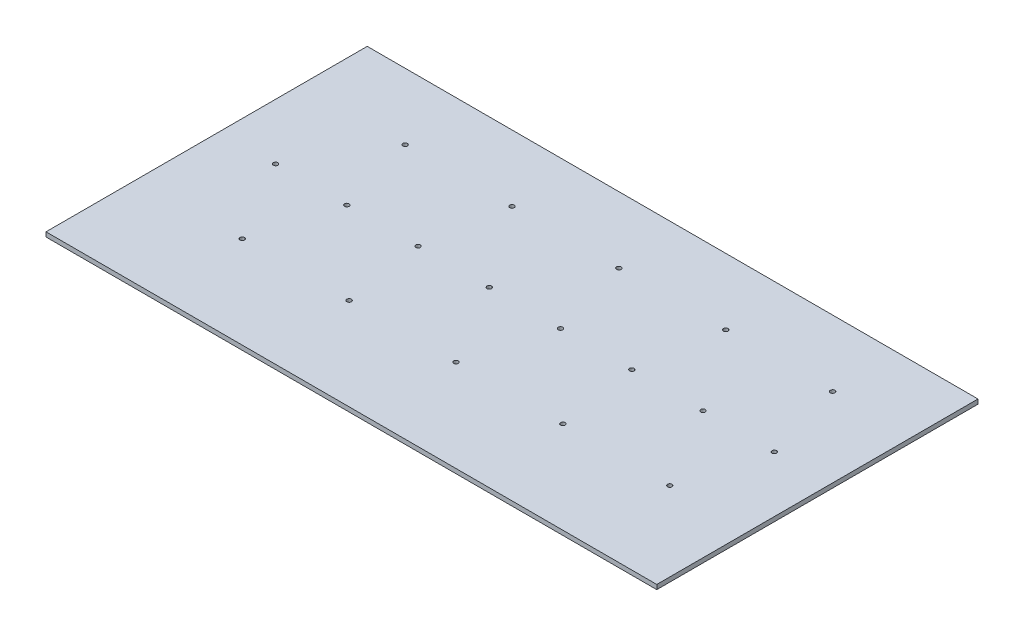
from build123d import *

# Parameters (mm, degrees)
SKETCH1_W               = 857.25
SKETCH1_H               = 450.85
BOSS_EXTRUDE1_DEPTH     = 6.35
CUT_EXTRUDE1_DEPTH      = 969.598785618
CUT_EXTRUDE1_DEPTH_BACK = 969.598785618
SKETCH2_R               = 3.175


with BuildPart() as part:
    # Sketch1 → Boss-Extrude1 (new body)
    with BuildSketch(Plane(origin=(0, 0, 0), x_dir=(1, 0, 0), z_dir=(0, 1, 0))):
        with Locations((428.625, 225.425)):
            Rectangle(SKETCH1_W, SKETCH1_H)
    extrude(amount=BOSS_EXTRUDE1_DEPTH)

    # Sketch2 → Cut-Extrude1 (cut, two sides: drawn at the far end of the back side and taken through both)
    with BuildSketch(Plane(origin=(0, 6.35, 0), x_dir=(1, 0, 0), z_dir=(0, 1, 0)).offset(-CUT_EXTRUDE1_DEPTH_BACK)):
        with Locations(Location((78.625, 243.56780677, 0), (0, 0, 270))):
            Circle(SKETCH2_R)
        with Locations(Location((178.625, 243.56780677, 0), (0, 0, 270))):
            Circle(SKETCH2_R)
        with Locations(Location((278.625, 243.56780677, 0), (0, 0, 270))):
            Circle(SKETCH2_R)
        with Locations(Location((378.625, 243.56780677, 0), (0, 0, 270))):
            Circle(SKETCH2_R)
        with Locations(Location((478.625, 243.56780677, 0), (0, 0, 270))):
            Circle(SKETCH2_R)
        with Locations(Location((578.625, 243.56780677, 0), (0, 0, 270))):
            Circle(SKETCH2_R)
        with Locations(Location((678.625, 243.56780677, 0), (0, 0, 270))):
            Circle(SKETCH2_R)
        with Locations(Location((778.625, 243.56780677, 0), (0, 0, 270))):
            Circle(SKETCH2_R)
        with Locations(Location((146.163, 357.86780677, 0), (0, 0, 270))):
            Circle(SKETCH2_R)
        with Locations(Location((296.163, 357.86780677, 0), (0, 0, 270))):
            Circle(SKETCH2_R)
        with Locations(Location((446.163, 357.86780677, 0), (0, 0, 270))):
            Circle(SKETCH2_R)
        with Locations(Location((596.163, 357.86780677, 0), (0, 0, 270))):
            Circle(SKETCH2_R)
        with Locations(Location((746.163, 357.86780677, 0), (0, 0, 270))):
            Circle(SKETCH2_R)
        with Locations(Location((146.163, 129.26780677, 0), (0, 0, 270))):
            Circle(SKETCH2_R)
        with Locations(Location((296.163, 129.26780677, 0), (0, 0, 270))):
            Circle(SKETCH2_R)
        with Locations(Location((446.163, 129.26780677, 0), (0, 0, 270))):
            Circle(SKETCH2_R)
        with Locations(Location((596.163, 129.26780677, 0), (0, 0, 270))):
            Circle(SKETCH2_R)
        with Locations(Location((746.163, 129.26780677, 0), (0, 0, 270))):
            Circle(SKETCH2_R)
    extrude(amount=CUT_EXTRUDE1_DEPTH + CUT_EXTRUDE1_DEPTH_BACK, mode=Mode.SUBTRACT)


solid = part.part
